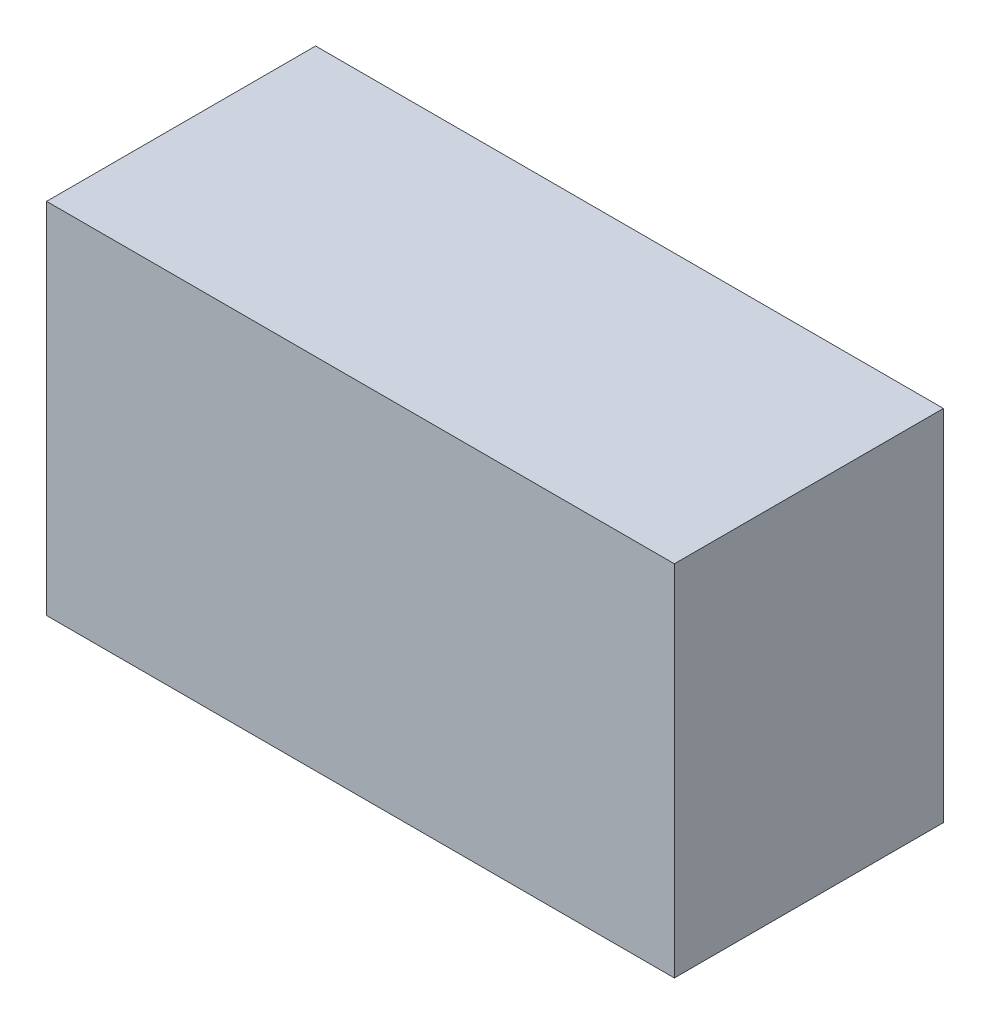
from build123d import *

# Parameters (mm, degrees)
SKETCH_1_W      = 7
SKETCH_1_H      = 4
EXTRUDE_1_DEPTH = 3


with BuildPart() as part:
    # ｽｹｯﾁ1 → ﾎﾞｽ - 押し出し1 (new body)
    with BuildSketch(Plane.XY):
        with Locations((3.5, 2)):
            Rectangle(SKETCH_1_W, SKETCH_1_H)
    extrude(amount=EXTRUDE_1_DEPTH)


solid = part.part
